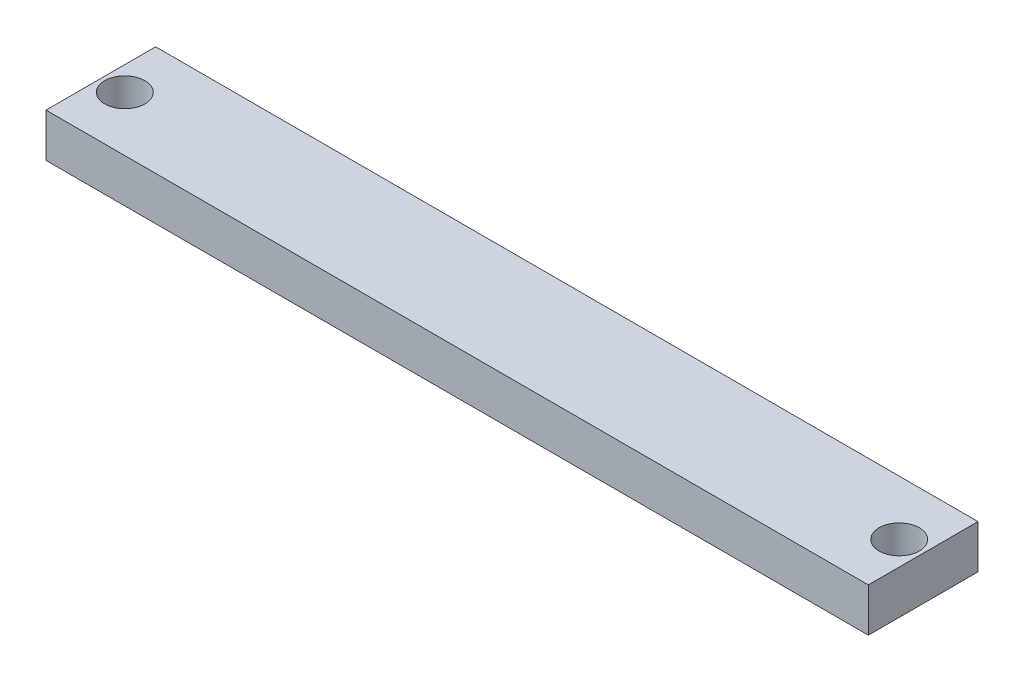
from build123d import *

# Parameters (mm, degrees)
SKETCH1_W           = 60
SKETCH1_H           = 8
SKETCH1_R           = 1.47
BOSS_EXTRUDE1_DEPTH = 3.18


with BuildPart() as part:
    # Sketch1 → Boss-Extrude1 (new body)
    with BuildSketch(Plane(origin=(0, 0, 0), x_dir=(1, 0, 0), z_dir=(0, 1, 0))):
        Rectangle(SKETCH1_W, SKETCH1_H)
        with Locations(Location((-28.25, 0, 0), (0, 0, 90))):
            Circle(SKETCH1_R, mode=Mode.SUBTRACT)
        with Locations(Location((28.25, 0, 0), (0, 0, 90))):
            Circle(SKETCH1_R, mode=Mode.SUBTRACT)
    extrude(amount=BOSS_EXTRUDE1_DEPTH)


solid = part.part
